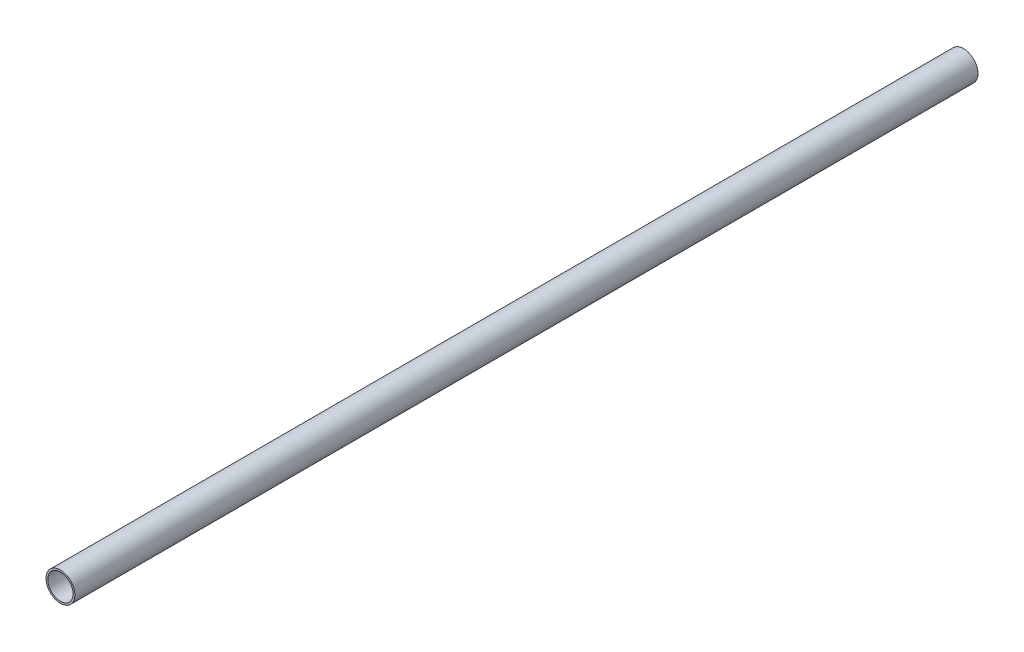
from build123d import *

# Parameters (mm, degrees)
SKETCH1_R           = 8
SKETCH1_R_2         = 7
BOSS_EXTRUDE1_DEPTH = 500


with BuildPart() as part:
    # Sketch1 → Boss-Extrude1 (new body)
    with BuildSketch(Plane.XY):
        Circle(SKETCH1_R)
        Circle(SKETCH1_R_2, mode=Mode.SUBTRACT)
    extrude(amount=BOSS_EXTRUDE1_DEPTH)


solid = part.part
